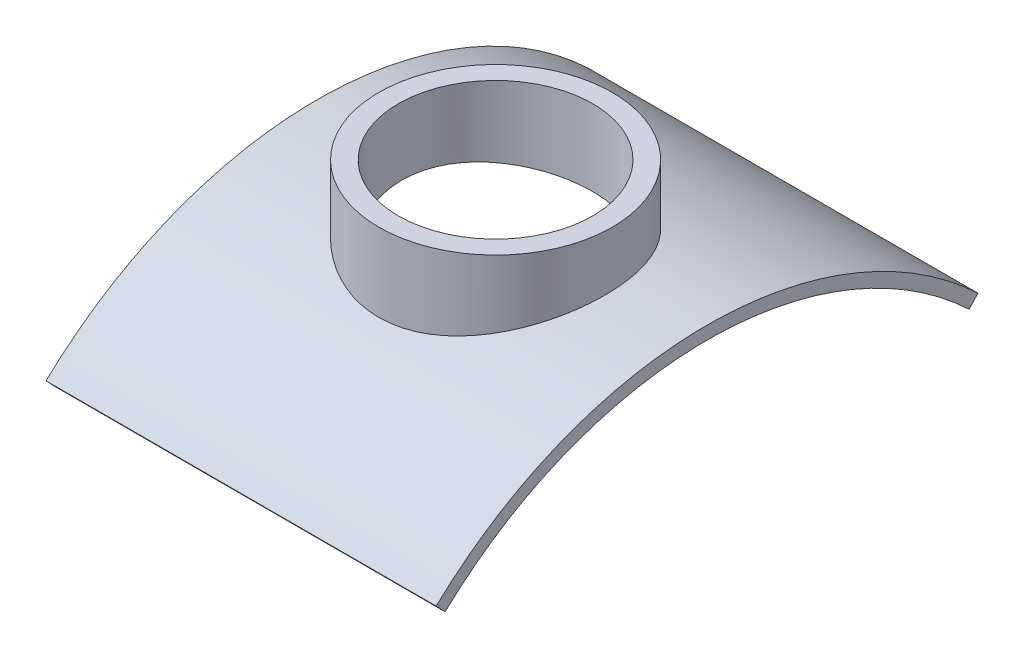
from build123d import *

# Parameters (mm, degrees)
EXTRUDE_THIN1_DEPTH = 76.2
EXTRUDE1_REACH      = 107.917
EXTRUDE1_END_RADIUS = 76.967998962
SKETCH2_R           = 22.797803907
SKETCH3_R           = 18.98465739
EXTRUDE2_DEPTH      = 76.2


with BuildPart() as part:
    # Sketch1 → Extrude-Thin1 (new body)
    with BuildSketch(Plane(origin=(0, 0, 0), x_dir=(0, 0, -1), z_dir=(1, 0, 0))):
        with BuildLine():
            ThreePointArc((-40.374745946, 0), (12.536707256, 21.071210286), (65.448160458, 0))
            Line((65.448160458, 0), (63.702043982, -1.84463472))
            ThreePointArc((63.702043982, -1.84463472), (12.536707256, 18.531210286), (-38.628629469, -1.84463472))
            Line((-38.628629469, -1.84463472), (-40.374745946, 0))
        make_face()
    extrude(amount=-EXTRUDE_THIN1_DEPTH)

    # Extrude1: up to this cylinder (the profile starts outside it)
    extrude1_end = Plane(origin=(-37.931127, -55.896788676, -12.536707256), z_dir=(1, 0, 0)) * Cylinder(EXTRUDE1_END_RADIUS, 370.769997925, mode=Mode.PRIVATE)
    # Sketch2 → Extrude1 (add, up to the surface)
    with BuildSketch(Plane(origin=(0, 31.75, 0), x_dir=(-1, 0, 0), z_dir=(0, 1, 0)), mode=Mode.PRIVATE) as extrude1_sk1:
        with Locations(Location((37.931127378, -9.159254826, 0), (0, 0, 90))):
            Circle(SKETCH2_R)
    extrude1_tool1 = extrude(extrude1_sk1.sketch, amount=-EXTRUDE1_REACH, mode=Mode.PRIVATE) - extrude1_end
    add(extrude1_tool1.solids().sort_by_distance((-37.931127, 31.75, -9.159255))[0])

    # Sketch3 → Extrude2 (cut)
    with BuildSketch(Plane(origin=(0, 31.75, 0), x_dir=(-1, 0, 0), z_dir=(0, 1, 0))):
        with Locations(Location((37.931127378, -9.159254826, 0), (0, 0, 90))):
            Circle(SKETCH3_R)
    extrude(amount=-EXTRUDE2_DEPTH, mode=Mode.SUBTRACT)


solid = part.part
